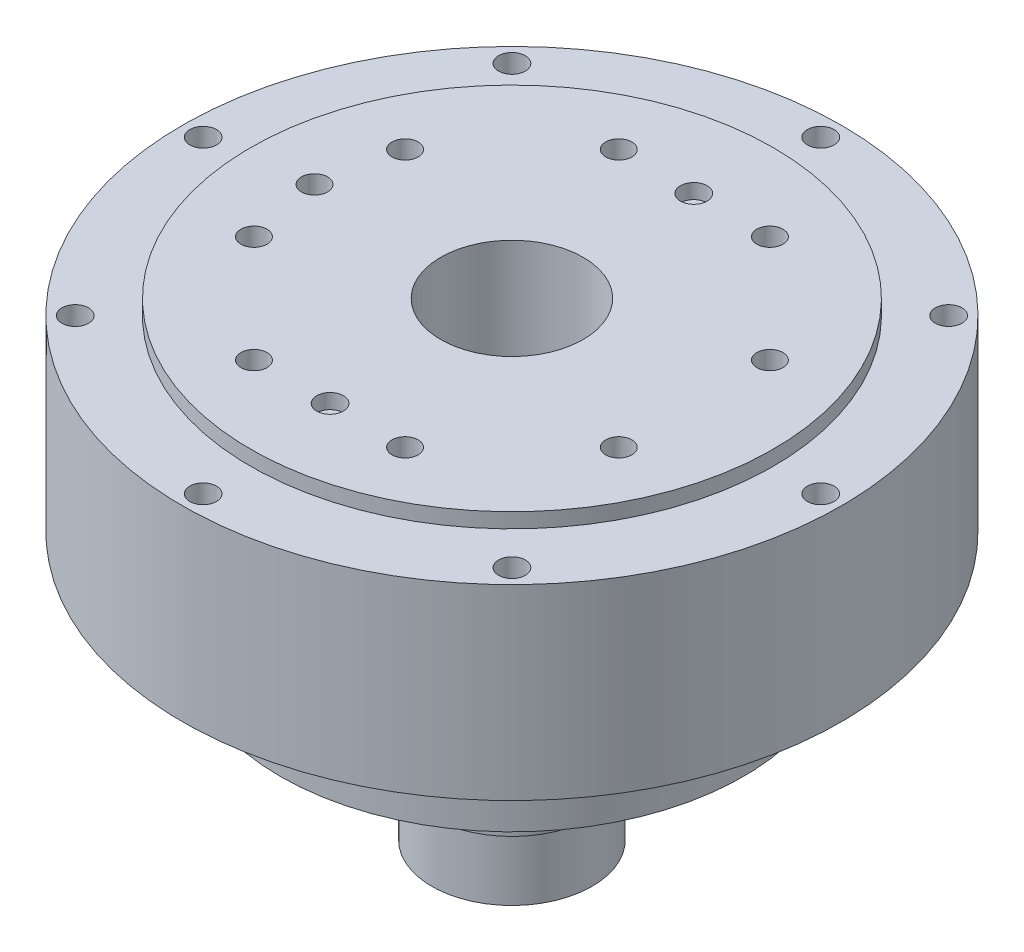
from build123d import *

# Parameters (mm, degrees)
SKETCH2_R          = 4.5
CUT_EXTRUDE1_DEPTH = 220.205383146
SKETCH4_R          = 4.4
CUT_EXTRUDE3_DEPTH = 18
SKETCH5_R          = 4.5
CUT_EXTRUDE4_DEPTH = 5
SKETCH6_R          = 24
CUT_EXTRUDE5_DEPTH = 223.724044504


with BuildPart() as part:
    # Sketch1 → Revolve1 (revolve)
    with BuildSketch(Plane(origin=(0, 0, 0), x_dir=(0, 0, -1), z_dir=(1, 0, 0)), mode=Mode.PRIVATE) as revolve1_sk:
        Polygon((0, 0), (-27, 0), (-27, 20.5), (-27.5, 20.5), (-27.5, 45.55), (-42.5, 45.55), (-42.5, 57.55), (-78, 57.55), (-78, 67.843005088), (-42.911855869, 67.843005088), (-42.911855869, 74.568826386), (-50.146203661, 74.568826386), (-50.146203661, 79), (-85.75, 79), (-85.75, 90), (-111, 90), (-111, 153), (-88, 153), (-88, 158), (0, 158), align=None)
    revolve(revolve1_sk.sketch.rotate(Axis((0, 0, 0), (0, 1, 0)), 180), axis=Axis((0, 0, 0), (0, 1, 0)))

    # Sketch2 → Cut-Extrude1 (cut, through all)
    with BuildSketch(Plane(origin=(0, 153, 0), x_dir=(1, 0, 0), z_dir=(0, 1, 0))):
        with Locations(Location((-104, 0, 0), (0, 0, 270))):
            Circle(SKETCH2_R)
        with Locations(Location((-73.539105243, 73.539105243, 0), (0, 0, 270))):
            Circle(SKETCH2_R)
        with Locations(Location((0, 104, 0), (0, 0, 270))):
            Circle(SKETCH2_R)
        with Locations(Location((73.539105243, 73.539105243, 0), (0, 0, 270))):
            Circle(SKETCH2_R)
        with Locations(Location((104, 0, 0), (0, 0, 270))):
            Circle(SKETCH2_R)
        with Locations(Location((73.539105243, -73.539105243, 0), (0, 0, 270))):
            Circle(SKETCH2_R)
        with Locations(Location((0, -104, 0), (0, 0, 270))):
            Circle(SKETCH2_R)
        with Locations(Location((-73.539105243, -73.539105243, 0), (0, 0, 270))):
            Circle(SKETCH2_R)
    extrude(amount=-CUT_EXTRUDE1_DEPTH, mode=Mode.SUBTRACT)

    # Sketch4 → Cut-Extrude3 (cut)
    with BuildSketch(Plane(origin=(0, 158, 0), x_dir=(1, 0, 0), z_dir=(0, 1, 0))):
        with Locations(Location((-66.5, 0, 0), (0, 0, 270))):
            Circle(SKETCH4_R)
        with Locations(Location((-61.437988912, 25.448448252, 0), (0, 0, 270))):
            Circle(SKETCH4_R)
        with Locations(Location((-25.448448252, 61.437988912, 0), (0, 0, 270))):
            Circle(SKETCH4_R)
        with Locations(Location((25.448448252, 61.437988912, 0), (0, 0, 270))):
            Circle(SKETCH4_R)
        with Locations(Location((61.437988912, 25.448448252, 0), (0, 0, 270))):
            Circle(SKETCH4_R)
        with Locations(Location((61.437988912, -25.448448252, 0), (0, 0, 270))):
            Circle(SKETCH4_R)
        with Locations(Location((25.448448252, -61.437988912, 0), (0, 0, 270))):
            Circle(SKETCH4_R)
        with Locations(Location((-25.448448252, -61.437988912, 0), (0, 0, 270))):
            Circle(SKETCH4_R)
        with Locations(Location((-61.437988912, -25.448448252, 0), (0, 0, 270))):
            Circle(SKETCH4_R)
    extrude(amount=-CUT_EXTRUDE3_DEPTH, mode=Mode.SUBTRACT)

    # Sketch5 → Cut-Extrude4 (cut)
    with BuildSketch(Plane(origin=(0, 158, 0), x_dir=(1, 0, 0), z_dir=(0, 1, 0))):
        with Locations(Location((0, -61.25, 0), (0, 0, 270))):
            Circle(SKETCH5_R)
        with Locations(Location((0, 61.25, 0), (0, 0, 270))):
            Circle(SKETCH5_R)
    extrude(amount=-CUT_EXTRUDE4_DEPTH, mode=Mode.SUBTRACT)

    # Sketch6 → Cut-Extrude5 (cut, through all)
    with BuildSketch(Plane.XZ):
        with Locations(Location((0, 0, 0), (0, 0, 270))):
            Circle(SKETCH6_R)
    extrude(amount=-CUT_EXTRUDE5_DEPTH, mode=Mode.SUBTRACT)


solid = part.part
